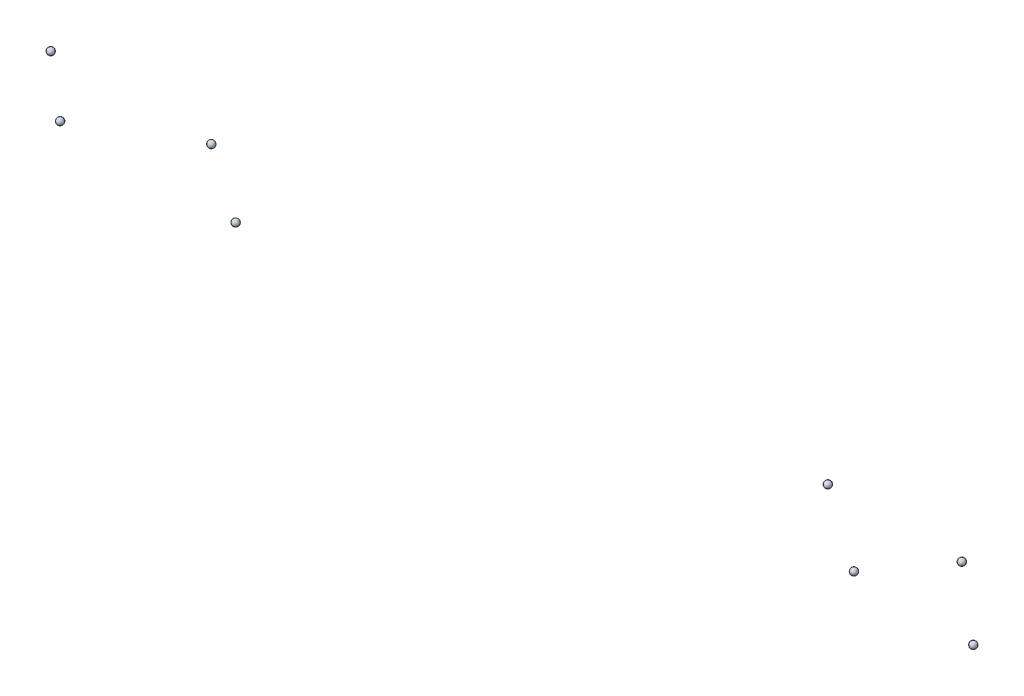
from build123d import *


with BuildPart() as part:
    # Sketch1 → Revolve1 (revolve)
    with BuildSketch(Plane(origin=(0, 0, 0), x_dir=(1, 0, 0), z_dir=(0, 1, 0))):
        with BuildLine():
            Line((127, 6.35), (127, 0))
            Line((127, 0), (127, -6.35))
            ThreePointArc((127, -6.35), (133.35, 0), (127, 6.35))
        make_face()
    revolve(axis=Axis((127, 0, -6.35), (0, 0, 1)))


with BuildPart() as body_2:
    # Sketch1<3> → Revolve2 (revolve)
    with BuildSketch(Plane(origin=(0, 0, 0), x_dir=(1, 0, 0), z_dir=(0, 1, 0))):
        with BuildLine():
            Line((-127, -6.35), (-127, 0))
            Line((-127, 0), (-127, 6.35))
            ThreePointArc((-127, 6.35), (-133.35, 0), (-127, -6.35))
        make_face()
    revolve(axis=Axis((-127, 0, -6.35), (0, 0, 1)))


with BuildPart() as body_3:
    # Sketch6 → Revolve3 (revolve)
    with BuildSketch(Plane.XY.offset(-34.29)):
        with BuildLine():
            Line((-111.76, -152.4), (-111.76, -158.75))
            ThreePointArc((-111.76, -158.75), (-105.41, -152.4), (-111.76, -146.05))
            Line((-111.76, -146.05), (-111.76, -152.4))
        make_face()
    revolve(axis=Axis((-111.76, -158.75, -34.29), (0, 1, 0)))


with BuildPart() as body_4:
    # Sketch4 → Revolve4 (revolve)
    with BuildSketch(Plane.XY.offset(-36.322)):
        with BuildLine():
            Line((112.3696, -161.925), (112.3696, -155.575))
            ThreePointArc((112.3696, -155.575), (106.0196, -161.925), (112.3696, -168.275))
            Line((112.3696, -168.275), (112.3696, -161.925))
        make_face()
    revolve(axis=Axis((112.3696, -155.575, -36.322), (0, -1, 0)))


with BuildPart() as body_5:
    # Sketch14 → Revolve5 (revolve)
    with BuildSketch(Plane(origin=(0, -225.425, 0), x_dir=(1, 0, 0), z_dir=(0, 1, 0))):
        with BuildLine():
            ThreePointArc((-1343.66, 87.63), (-1337.31, 93.98), (-1343.66, 100.33))
            Line((-1343.66, 100.33), (-1343.66, 93.98))
            Line((-1343.66, 93.98), (-1343.66, 87.63))
        make_face()
    revolve(axis=Axis((-1343.66, -225.425, -100.33), (0, 0, 1)))


with BuildPart() as body_6:
    # Sketch13 → Revolve6 (revolve)
    with BuildSketch(Plane.XY.offset(-93.98)):
        with BuildLine():
            Line((-1676.4, -225.425), (-1676.4, -219.075))
            ThreePointArc((-1676.4, -219.075), (-1682.75, -225.425), (-1676.4, -231.775))
            Line((-1676.4, -231.775), (-1676.4, -225.425))
        make_face()
    revolve(axis=Axis((-1676.4, -219.075, -93.98), (0, -1, 0)))


with BuildPart() as body_7:
    # Sketch10 → Revolve7 (revolve)
    with BuildSketch(Plane(origin=(-1358.9, 0, 0), x_dir=(0, 0, -1), z_dir=(1, 0, 0))):
        with BuildLine():
            ThreePointArc((63.155340242, -95.25), (69.505340242, -88.9), (63.155340242, -82.55))
            Line((63.155340242, -82.55), (63.155340242, -88.9))
            Line((63.155340242, -88.9), (63.155340242, -95.25))
        make_face()
    revolve(axis=Axis((-1358.9, -82.55, -63.155340242), (0, -1, 0)))


with BuildPart() as body_8:
    # Sketch11 → Revolve8 (revolve)
    with BuildSketch(Plane.XY.offset(-63.5)):
        with BuildLine():
            Line((-1663.7, -95.25), (-1663.7, -88.9))
            Line((-1663.7, -88.9), (-1663.7, -82.55))
            ThreePointArc((-1663.7, -82.55), (-1670.05, -88.9), (-1663.7, -95.25))
        make_face()
    revolve(axis=Axis((-1663.7, -95.25, -63.5), (0, 1, 0)))


solid = Compound([part.part, body_2.part, body_3.part, body_4.part, body_5.part, body_6.part, body_7.part, body_8.part])
